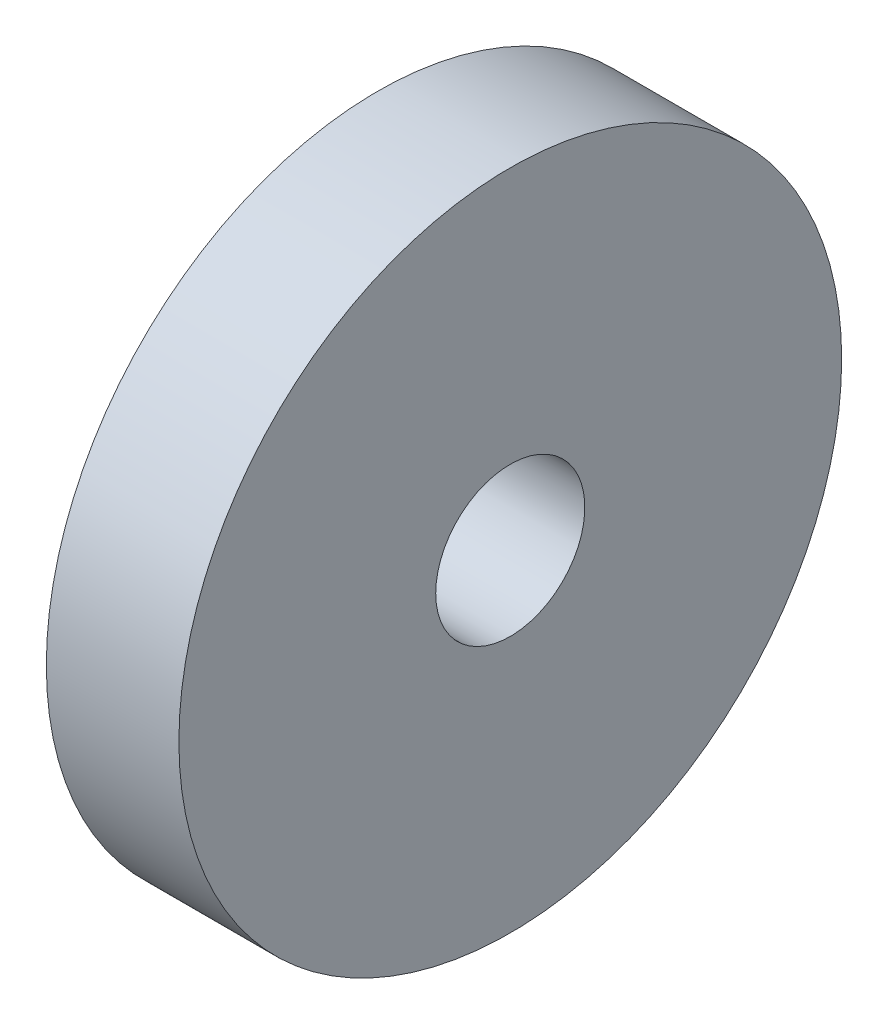
from build123d import *

# Parameters (mm, degrees)
SKETCH1_R               = 10
BOSS_EXTRUDE1_DEPTH     = 8
SKETCH2_R               = 13.5
CUT_EXTRUDE1_DEPTH      = 2
SKETCH3_R               = 13.5
CUT_EXTRUDE2_DEPTH      = 2
CUT_EXTRUDE3_DEPTH      = 15.696938457
CUT_EXTRUDE3_DEPTH_BACK = 15.696938457
SKETCH4_R               = 2.25


with BuildPart() as part:
    # Sketch1 → Boss-Extrude1 (new body)
    with BuildSketch(Plane(origin=(0, 0, 0), x_dir=(0, 0, -1), z_dir=(1, 0, 0))):
        Circle(SKETCH1_R)
    extrude(amount=BOSS_EXTRUDE1_DEPTH)

    # Sketch2 → Cut-Extrude1 (cut)
    with BuildSketch(Plane(origin=(8, 0, 0), x_dir=(0, 0, -1), z_dir=(1, 0, 0))):
        Circle(SKETCH2_R)
    extrude(amount=-CUT_EXTRUDE1_DEPTH, mode=Mode.SUBTRACT)

    # Sketch3 → Cut-Extrude2 (cut)
    with BuildSketch(Plane.ZY):
        Circle(SKETCH3_R)
    extrude(amount=-CUT_EXTRUDE2_DEPTH, mode=Mode.SUBTRACT)

    # Sketch4 → Cut-Extrude3 (cut, two sides: drawn at the far end of the back side and taken through both)
    with BuildSketch(Plane.ZY.offset(-2).offset(-CUT_EXTRUDE3_DEPTH_BACK)):
        Circle(SKETCH4_R)
    extrude(amount=CUT_EXTRUDE3_DEPTH + CUT_EXTRUDE3_DEPTH_BACK, mode=Mode.SUBTRACT)


solid = part.part
